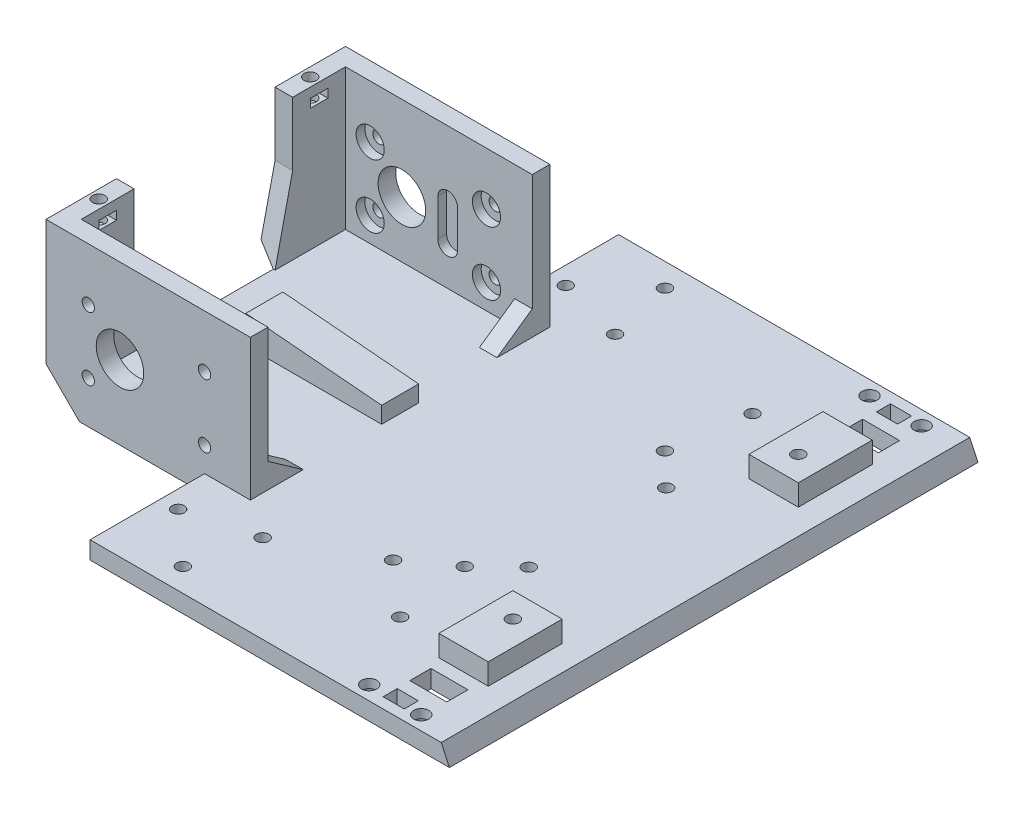
from build123d import *

# Parameters (mm, degrees)
BOSS_EXTRUDE1_DEPTH = 5
BOSS_EXTRUDE2_DEPTH = 32
CUT_EXTRUDE2_DEPTH  = 5
CUT_EXTRUDE3_DEPTH  = 5
SKETCH7_R           = 6.75
SKETCH7_R_2         = 1.75
C_L_NG_C_DEPTH      = 146.27301883
SKETCH14_R          = 4
CUT_EXTRUDE8_DEPTH  = 2.5
CUT_EXTRUDE9_START  = -2.5
SKETCH15_R          = 4
CUT_EXTRUDE9_DEPTH  = 2.5
CUT_EXTRUDE15_DEPTH = 89
BOSS_EXTRUDE3_DEPTH = 8
SKETCH28_R          = 1.75
CUT_EXTRUDE16_DEPTH = 7
SKETCH29_W          = 5
SKETCH29_H          = 2.45
CUT_EXTRUDE17_DEPTH = 5
CUT_EXTRUDE18_DEPTH = 151
SKETCH30_W          = 10.5
SKETCH30_H          = 6
SKETCH30_W_2        = 6
SKETCH30_H_2        = 4
CUT_EXTRUDE19_DEPTH = 10
SKETCH31_R          = 2.15
CUT_EXTRUDE20_DEPTH = 10
SKETCH32_R          = 3.5
CUT_EXTRUDE21_DEPTH = 2.5
SKETCH34_W          = 6
SKETCH34_H          = 10.5
CUT_EXTRUDE23_DEPTH = 5
SKETCH40_R          = 1.75
CUT_EXTRUDE27_DEPTH = 5
SKETCH41_W          = 92.636025087
SKETCH41_H          = 10.5
BOSS_EXTRUDE5_DEPTH = 8
CUT_EXTRUDE28_DEPTH = 14
CUT_EXTRUDE34_DEPTH = 13.5
SKETCH49_R          = 1.75
CUT_EXTRUDE35_DEPTH = 10
SKETCH48_W          = 14
SKETCH48_H          = 21
BOSS_EXTRUDE6_DEPTH = 6
SKETCH50_R          = 1.75
CUT_EXTRUDE36_DEPTH = 19
SKETCH51_R          = 3.1
CUT_EXTRUDE37_DEPTH = 2.5


with BuildPart() as part:
    # Sketch1 → Boss-Extrude1 (new body)
    with BuildSketch(Plane(origin=(0, 0, 0), x_dir=(1, 0, 0), z_dir=(0, 1, 0))):
        Polygon((-25, 75), (-25, 42.5), (-70, 42.5), (-70, -42.5), (-25, -42.5), (-25, -75), (77, -75), (77, 75), align=None)
    extrude(amount=BOSS_EXTRUDE1_DEPTH)

    # Sketch3 → Boss-Extrude2 (add)
    with BuildSketch(Plane(origin=(0, 5, 0), x_dir=(1, 0, 0), z_dir=(0, 1, 0))):
        Polygon((-70, 17.5), (-65, 17.5), (-65, 37.5), (-17, 37.5), (-17, 27.5), (-12, 27.5), (-12, 42.5), (-70, 42.5), align=None)
        Polygon((-70, -17.5), (-70, -42.5), (-12, -42.5), (-12, -27.5), (-17, -27.5), (-17, -37.5), (-65, -37.5), (-65, -17.5), align=None)
    extrude(amount=BOSS_EXTRUDE2_DEPTH)

    # Sketch5 → Cut-Extrude2 (cut)
    with BuildSketch(Plane.ZY.offset(70)):
        Polygon((-17.5, 37), (-22.5, 37), (-22.5, 27), (-17.5, 5), align=None)
        Polygon((17.5, 5), (17.5, 37), (22.5, 37), (22.5, 27), align=None)
    extrude(amount=-CUT_EXTRUDE2_DEPTH, mode=Mode.SUBTRACT)

    # Sketch6 → Cut-Extrude3 (cut)
    with BuildSketch(Plane(origin=(-12, 0, 0), x_dir=(0, 0, -1), z_dir=(1, 0, 0))):
        Polygon((-27.5, 37), (-37.5, 37), (-37.5, 12), (-27.5, 5), align=None)
        Polygon((37.5, 12), (27.5, 5), (27.5, 37), (37.5, 37), align=None)
    extrude(amount=-CUT_EXTRUDE3_DEPTH, mode=Mode.SUBTRACT)

    # Sketch7 → Đục lỗ động cơ (cut, through all)
    with BuildSketch(Plane(origin=(0, 0, -42.5), x_dir=(-1, 0, 0), z_dir=(0, 0, -1))):
        with Locations((49, 21)):
            Circle(SKETCH7_R)
        with Locations((25, 30)):
            Circle(SKETCH7_R_2)
        with Locations((25, 12)):
            Circle(SKETCH7_R_2)
        with Locations((58, 30)):
            Circle(SKETCH7_R_2)
        with Locations((58, 12)):
            Circle(SKETCH7_R_2)
    extrude(amount=-C_L_NG_C_DEPTH, mode=Mode.SUBTRACT)

    # Sketch14 → Cut-Extrude8 (cut)
    with BuildSketch(Plane(origin=(0, 0, 37.5), x_dir=(-1, 0, 0), z_dir=(0, 0, -1))):
        with Locations((58, 30)):
            Circle(SKETCH14_R)
        with Locations((25, 30)):
            Circle(SKETCH14_R)
        with Locations((25, 12)):
            Circle(SKETCH14_R)
        with Locations((58, 12)):
            Circle(SKETCH14_R)
        with BuildLine():
            Line((38.8, 26.25), (38.8, 15.75))
            ThreePointArc((38.8, 15.75), (36, 12.95), (33.2, 15.75))
            Line((33.2, 15.75), (33.2, 26.25))
            ThreePointArc((33.2, 26.25), (36, 29.05), (38.8, 26.25))
        make_face()
    extrude(amount=-CUT_EXTRUDE8_DEPTH, mode=Mode.SUBTRACT)

    # Sketch15 → Cut-Extrude9 (cut)
    with BuildSketch(Plane.XY.offset(-37.5).offset(CUT_EXTRUDE9_START)):
        with Locations((-25, 30)):
            Circle(SKETCH15_R)
        with Locations((-25, 12)):
            Circle(SKETCH15_R)
        with Locations((-58, 12)):
            Circle(SKETCH15_R)
        with Locations((-58, 30)):
            Circle(SKETCH15_R)
        with BuildLine():
            Line((-33.2, 26.25), (-33.2, 15.75))
            ThreePointArc((-33.2, 15.75), (-36, 12.95), (-38.8, 15.75))
            Line((-38.8, 15.75), (-38.8, 26.25))
            ThreePointArc((-38.8, 26.25), (-36, 29.05), (-33.2, 26.25))
        make_face()
    extrude(amount=CUT_EXTRUDE9_DEPTH, mode=Mode.SUBTRACT)

    # Sketch25 → Cut-Extrude15 (cut)
    with BuildSketch(Plane.XY.offset(42.5)):
        Polygon((-70, 9.5), (-70, 0), (-60.5, 0), align=None)
    extrude(amount=-CUT_EXTRUDE15_DEPTH, mode=Mode.SUBTRACT)

    # Sketch27 → Boss-Extrude3 (add)
    with BuildSketch(Plane(origin=(0, 37, 0), x_dir=(1, 0, 0), z_dir=(0, 1, 0))):
        Polygon((-12, 42.5), (-70, 42.5), (-70, 22.5), (-65, 22.5), (-65, 37.5), (-12, 37.5), align=None)
        Polygon((-12, -37.5), (-12, -42.5), (-70, -42.5), (-70, -22.5), (-65, -22.5), (-65, -37.5), align=None)
    extrude(amount=BOSS_EXTRUDE3_DEPTH)

    # Sketch28 → Cut-Extrude16 (cut)
    with BuildSketch(Plane(origin=(0, 45, 0), x_dir=(1, 0, 0), z_dir=(0, 1, 0))):
        with Locations((-67.5, -30)):
            Circle(SKETCH28_R)
        with Locations((-67.5, 30)):
            Circle(SKETCH28_R)
    extrude(amount=-CUT_EXTRUDE16_DEPTH, mode=Mode.SUBTRACT)

    # Sketch29 → Cut-Extrude17 (cut)
    with BuildSketch(Plane.ZY.offset(70)):
        with Locations((-30, 41)):
            Rectangle(SKETCH29_W, SKETCH29_H)
        with Locations((30, 41)):
            Rectangle(SKETCH29_W, SKETCH29_H)
    extrude(amount=-CUT_EXTRUDE17_DEPTH, mode=Mode.SUBTRACT)

    # Sketch26 → Cut-Extrude18 (cut)
    with BuildSketch(Plane.XY.offset(75)):
        Polygon((74.668461709, 5), (77, 0), (77, 5), align=None)
    extrude(amount=-CUT_EXTRUDE18_DEPTH, mode=Mode.SUBTRACT)

    # Sketch30 → Cut-Extrude19 (cut)
    with BuildSketch(Plane(origin=(0, 0, 0), x_dir=(-1, 0, 0), z_dir=(0, -1, 0))):
        with Locations((-60.25, 61.25)):
            Rectangle(SKETCH30_W, SKETCH30_H)
        with Locations((-60.25, -61.25)):
            Rectangle(SKETCH30_W, SKETCH30_H)
        with Locations((-58.17, -70)):
            Rectangle(SKETCH30_W_2, SKETCH30_H_2)
        with Locations((-58.17, 70)):
            Rectangle(SKETCH30_W_2, SKETCH30_H_2)
    extrude(amount=-CUT_EXTRUDE19_DEPTH, mode=Mode.SUBTRACT)

    # Sketch31 → Cut-Extrude20 (cut)
    with BuildSketch(Plane(origin=(0, 0, 0), x_dir=(-1, 0, 0), z_dir=(0, -1, 0))):
        with Locations((-65, -71)):
            Circle(SKETCH31_R)
        with Locations((-50.22, -71)):
            Circle(SKETCH31_R)
        with Locations((-50.22, 71)):
            Circle(SKETCH31_R)
        with Locations((-65, 71)):
            Circle(SKETCH31_R)
    extrude(amount=-CUT_EXTRUDE20_DEPTH, mode=Mode.SUBTRACT)

    # Sketch32 → Cut-Extrude21 (cut)
    with BuildSketch(Plane(origin=(0, 0, 0), x_dir=(-1, 0, 0), z_dir=(0, -1, 0))):
        with Locations((-65, -71)):
            Circle(SKETCH32_R)
        with Locations((-50.22, -71)):
            Circle(SKETCH32_R)
        with Locations((-50.22, 71)):
            Circle(SKETCH32_R)
        with Locations((-65, 71)):
            Circle(SKETCH32_R)
    extrude(amount=-CUT_EXTRUDE21_DEPTH, mode=Mode.SUBTRACT)

    # Sketch34 → Cut-Extrude23 (cut)
    with BuildSketch(Plane(origin=(0, 0, 0), x_dir=(-1, 0, 0), z_dir=(0, -1, 0))):
        with Locations((53.546244223, 0)):
            Rectangle(SKETCH34_W, SKETCH34_H)
    extrude(amount=-CUT_EXTRUDE23_DEPTH, mode=Mode.SUBTRACT)

    # Sketch40 → Cut-Extrude27 (cut)
    with BuildSketch(Plane(origin=(0, 0, 0), x_dir=(-1, 0, 0), z_dir=(0, -1, 0))):
        with Locations((-38, -50)):
            Circle(SKETCH40_R)
        with Locations((-34.75, -28.4)):
            Circle(SKETCH40_R)
        with Locations((-44, -19.5)):
            Circle(SKETCH40_R)
        with Locations((20, -55)):
            Circle(SKETCH40_R)
        with Locations((5.25, -68.4)):
            Circle(SKETCH40_R)
        with Locations((1, -50)):
            Circle(SKETCH40_R)
        with Locations((1, 50)):
            Circle(SKETCH40_R)
        with Locations((5.25, 68.4)):
            Circle(SKETCH40_R)
        with Locations((20, 55)):
            Circle(SKETCH40_R)
        with Locations((-44, 19.5)):
            Circle(SKETCH40_R)
        with Locations((-34.75, 28.4)):
            Circle(SKETCH40_R)
        with Locations((-38, 50)):
            Circle(SKETCH40_R)
    extrude(amount=-CUT_EXTRUDE27_DEPTH, mode=Mode.SUBTRACT)

    # Sketch41 → Boss-Extrude5 (add)
    with BuildSketch(Plane(origin=(0, 5, 0), x_dir=(1, 0, 0), z_dir=(0, 1, 0))):
        with Locations((-4.228231679, 0)):
            Rectangle(SKETCH41_W, SKETCH41_H)
    extrude(amount=BOSS_EXTRUDE5_DEPTH)

    # Sketch42 → Cut-Extrude28 (cut)
    with BuildSketch(Plane.XY.offset(5.25)):
        Polygon((42.089780864, 5), (42.089780864, 13), (-50.546244223, 13), align=None)
    extrude(amount=-CUT_EXTRUDE28_DEPTH, mode=Mode.SUBTRACT)

    # Sketch47 → Cut-Extrude34 (cut)
    with BuildSketch(Plane.XY.offset(5.25)):
        Polygon((-12, 9.671165958), (-12, 5), (42.089780864, 5), align=None)
    extrude(amount=-CUT_EXTRUDE34_DEPTH, mode=Mode.SUBTRACT)

    # Sketch49 → Cut-Extrude35 (cut)
    with BuildSketch(Plane(origin=(0, 0, 0), x_dir=(-1, 0, 0), z_dir=(0, -1, 0))):
        with Locations((-23, -37)):
            Circle(SKETCH49_R)
    extrude(amount=-CUT_EXTRUDE35_DEPTH, mode=Mode.SUBTRACT)

    # Sketch48 → Boss-Extrude6 (add)
    with BuildSketch(Plane(origin=(0, 5, 0), x_dir=(1, 0, 0), z_dir=(0, 1, 0))):
        with Locations((60.5, 44)):
            Rectangle(SKETCH48_W, SKETCH48_H)
        with Locations((60.5, -44)):
            Rectangle(SKETCH48_W, SKETCH48_H)
    extrude(amount=BOSS_EXTRUDE6_DEPTH)

    # Sketch50 → Cut-Extrude36 (cut)
    with BuildSketch(Plane(origin=(0, 0, 0), x_dir=(-1, 0, 0), z_dir=(0, -1, 0))):
        with Locations((-60.5, -40.5)):
            Circle(SKETCH50_R)
        with Locations((-60.5, 40.5)):
            Circle(SKETCH50_R)
    extrude(amount=-CUT_EXTRUDE36_DEPTH, mode=Mode.SUBTRACT)

    # Sketch51 → Cut-Extrude37 (cut)
    with BuildSketch(Plane(origin=(0, 0, 0), x_dir=(-1, 0, 0), z_dir=(0, -1, 0))):
        with Locations((-60.5, -40.5)):
            Circle(SKETCH51_R)
        with Locations((-44, -19.5)):
            Circle(SKETCH51_R)
        with Locations((-34.75, -28.4)):
            Circle(SKETCH51_R)
        with Locations((-38, -50)):
            Circle(SKETCH51_R)
        with Locations((-23, -37)):
            Circle(SKETCH51_R)
        with Locations((1, -50)):
            Circle(SKETCH51_R)
        with Locations((5.25, -68.4)):
            Circle(SKETCH51_R)
        with Locations((20, -55)):
            Circle(SKETCH51_R)
        with Locations((20, 55)):
            Circle(SKETCH51_R)
        with Locations((5.25, 68.4)):
            Circle(SKETCH51_R)
        with Locations((1, 50)):
            Circle(SKETCH51_R)
        with Locations((-38, 50)):
            Circle(SKETCH51_R)
        with Locations((-34.75, 28.4)):
            Circle(SKETCH51_R)
        with Locations((-44, 19.5)):
            Circle(SKETCH51_R)
        with Locations((-60.5, 40.5)):
            Circle(SKETCH51_R)
    extrude(amount=-CUT_EXTRUDE37_DEPTH, mode=Mode.SUBTRACT)


solid = part.part
